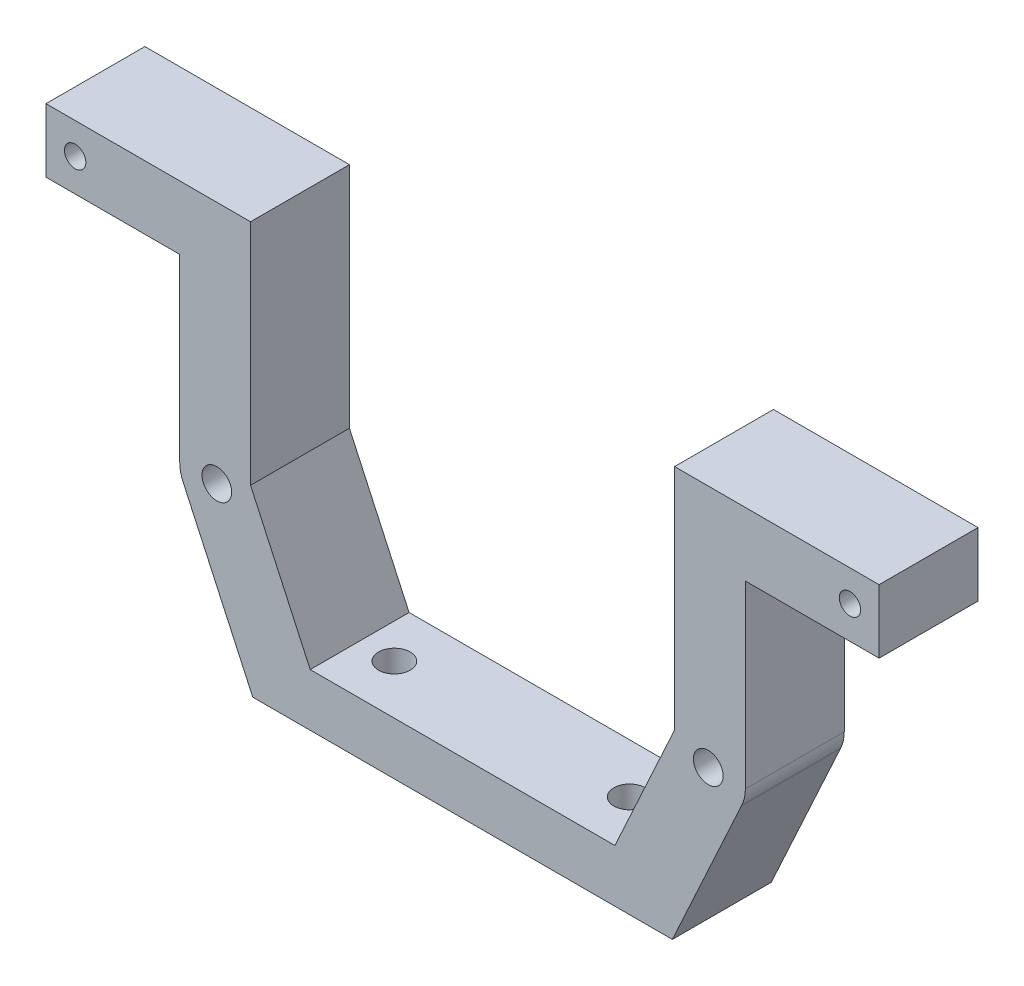
from build123d import *

# Parameters (mm, degrees)
SKETCH1_R      = 1.3716
SKETCH1_R_2    = 1.905
EXTRUDE1_DEPTH = 12.7
SKETCH2_R      = 2.032
EXTRUDE2_DEPTH = 9.652


with BuildPart() as part:
    # Sketch1 → Extrude1 (new body)
    with BuildSketch(Plane.XY):
        with BuildLine():
            Line((-27.225769594, 10.969260914), (-19.564927608, -5.695593273))
            Line((-19.564927608, -5.695593273), (19.564927608, -5.695593273))
            Line((19.564927608, -5.695593273), (27.225769594, 10.969260914))
            Line((27.225769594, 10.969260914), (27.225769594, 40.278404046))
            Line((27.225769594, 40.278404046), (53.492478146, 40.278404046))
            Line((53.492478146, 40.278404046), (53.492478146, 32.09814334))
            Line((53.492478146, 32.09814334), (36.318856593, 32.09814334))
            Line((36.318856593, 32.09814334), (36.318856593, 8.979309022))
            ThreePointArc((36.318856593, 8.979309022), (36.193812026, 7.894938195), (35.825242223, 6.867488665))
            Line((35.825242223, 6.867488665), (26.944030552, -12.452071481))
            Line((26.944030552, -12.452071481), (-26.944030552, -12.452071481))
            Line((-26.944030552, -12.452071481), (-35.825242223, 6.867488665))
            ThreePointArc((-35.825242223, 6.867488665), (-36.193812026, 7.894938195), (-36.318856593, 8.979309022))
            Line((-36.318856593, 8.979309022), (-36.318856593, 32.09814334))
            Line((-36.318856593, 32.09814334), (-53.492478146, 32.09814334))
            Line((-53.492478146, 32.09814334), (-53.492478146, 40.278404046))
            Line((-53.492478146, 40.278404046), (-27.225769594, 40.278404046))
            Line((-27.225769594, 40.278404046), (-27.225769594, 10.969260914))
        make_face()
        with Locations((-49.749305957, 36.28427137)):
            Circle(SKETCH1_R, mode=Mode.SUBTRACT)
        with Locations(Location((49.749305957, 36.28427137, 0), (0, 0, 180))):
            Circle(SKETCH1_R, mode=Mode.SUBTRACT)
        with Locations(Location((31.554570289, 8.979309022, 0), (0, 0, 180))):
            Circle(SKETCH1_R_2, mode=Mode.SUBTRACT)
        with Locations((-31.554570289, 8.979309022)):
            Circle(SKETCH1_R_2, mode=Mode.SUBTRACT)
    extrude(amount=EXTRUDE1_DEPTH)

    # Sketch2 → Extrude2 (cut)
    with BuildSketch(Plane.XZ.offset(12.452071481)):
        with Locations(Location((15.105130103, 6.35, 0), (0, 0, 270))):
            Circle(SKETCH2_R)
        with Locations(Location((-15.105130103, 6.35, 0), (0, 0, 270))):
            Circle(SKETCH2_R)
    extrude(amount=-EXTRUDE2_DEPTH, mode=Mode.SUBTRACT)


solid = part.part
